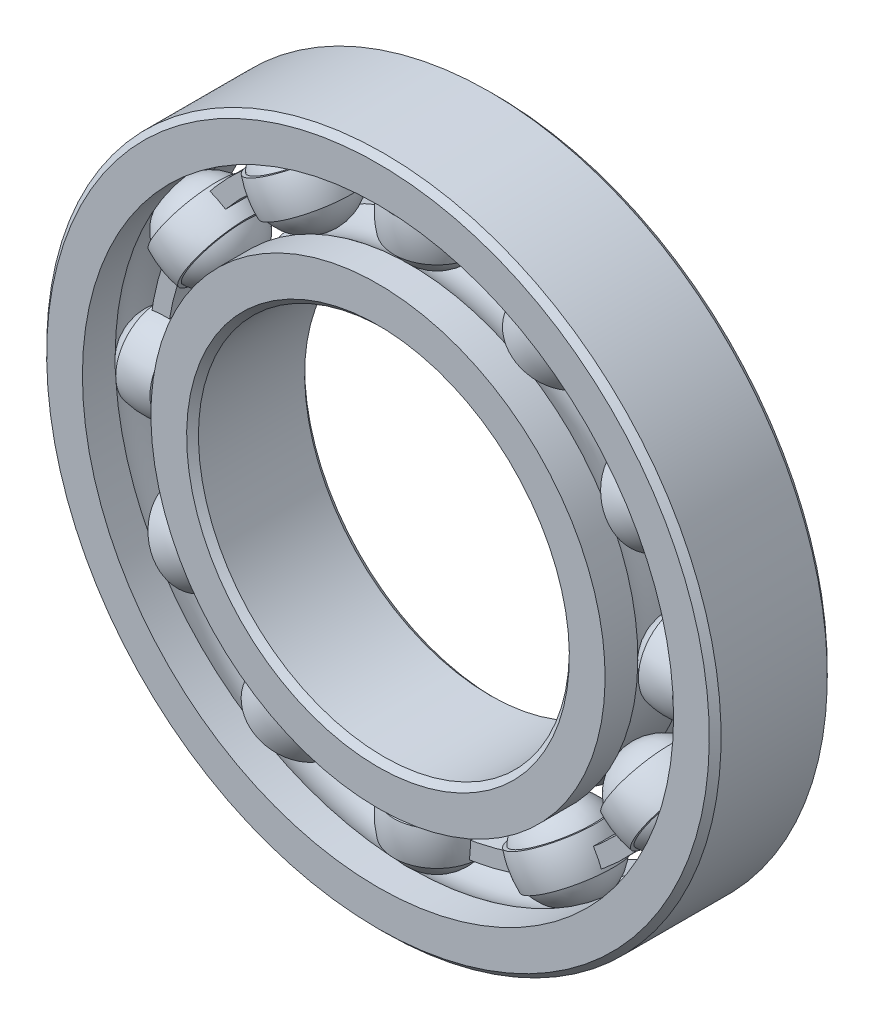
from build123d import *

# Parameters (mm, degrees)
CIRPATTERN1_COUNT   = 12
SKETCH9_R           = 26.218173077
SKETCH9_R_2         = 24.60625
BOSS_EXTRUDE1_DEPTH = 0.926041667


with BuildPart() as part:
    # Sketch7 → Revolve6 (revolve)
    with BuildSketch(Plane(origin=(0, 0, 0), x_dir=(0, 0, -1), z_dir=(1, 0, 0)), mode=Mode.PRIVATE) as revolve6_sk:
        with BuildLine():
            Line((5.000625, 31.75), (5.55625, 31.194375))
            Line((5.55625, 31.194375), (5.55625, 27.830096154))
            Line((5.55625, 27.830096154), (2.469444444, 27.830096154))
            ThreePointArc((2.469444444, 27.830096154), (0, 28.667203076), (-2.469444444, 27.830096154))
            Line((-2.469444444, 27.830096154), (-5.55625, 27.830096154))
            Line((-5.55625, 27.830096154), (-5.55625, 31.194375))
            Line((-5.55625, 31.194375), (-5.000625, 31.75))
            Line((-5.000625, 31.75), (5.000625, 31.75))
        make_face()
    revolve(revolve6_sk.sketch.rotate(Axis((0, 0, 5.55625), (0, 0, -1)), 180), axis=Axis((0, 0, 5.55625), (0, 0, -1)))


with BuildPart() as body_2:
    # Sketch3 → Revolve3 (revolve)
    with BuildSketch(Plane(origin=(0, 0, 0), x_dir=(0, 0, -1), z_dir=(1, 0, 0)), mode=Mode.PRIVATE) as revolve3_sk:
        with BuildLine():
            Line((-5.000625, 17.4625), (-5.55625, 18.018125))
            Line((-5.55625, 18.018125), (-5.55625, 21.382403846))
            Line((-5.55625, 21.382403846), (-2.469444444, 21.382403846))
            ThreePointArc((-2.469444444, 21.382403846), (0, 20.545296924), (2.469444444, 21.382403846))
            Line((2.469444444, 21.382403846), (5.55625, 21.382403846))
            Line((5.55625, 21.382403846), (5.55625, 18.018125))
            Line((5.55625, 18.018125), (5.000625, 17.4625))
            Line((5.000625, 17.4625), (-5.000625, 17.4625))
        make_face()
    revolve(revolve3_sk.sketch.rotate(Axis((0, 0, 5.55625), (0, 0, -1)), 180), axis=Axis((0, 0, 5.55625), (0, 0, -1)))


with BuildPart() as body_3:
    # Sketch4 → Revolve4 (revolve)
    with BuildSketch(Plane(origin=(0, 0, 0), x_dir=(0, 0, -1), z_dir=(1, 0, 0))):
        with BuildLine():
            Line((-4.060953076, 24.60625), (4.060953076, 24.60625))
            ThreePointArc((4.060953076, 24.60625), (0, 28.667203076), (-4.060953076, 24.60625))
        make_face()
    revolve(axis=Axis((0, 24.60625, 4.060953076), (0, 0, -1)))


with BuildPart() as body_4:
    # Sketch8 → Revolve7 (revolve)
    with BuildSketch(Plane(origin=(0, 0, 0), x_dir=(0, 0, -1), z_dir=(1, 0, 0))):
        with BuildLine():
            Line((-3.727337372, 26.218173077), (-4.032156143, 26.218173077))
            ThreePointArc((-4.032156143, 26.218173077), (-4.184565529, 24.60625), (-4.032156143, 22.994326923))
            Line((-4.032156143, 22.994326923), (-3.727337372, 22.994326923))
            ThreePointArc((-3.727337372, 22.994326923), (-4.060953076, 24.60625), (-3.727337372, 26.218173077))
        make_face()
    revolve(axis=Axis((0, 31.75, 0), (0, -1, 0)))


with BuildPart() as cirpattern1_1:
    # CirPattern1: pattern copy
    add(body_4.part.rotate(Axis((0, 0, 0), (0, 0, 1)), 1 * 360 / CIRPATTERN1_COUNT))


with BuildPart() as cirpattern1_2:
    # CirPattern1: pattern copy
    add(body_4.part.rotate(Axis((0, 0, 0), (0, 0, 1)), 2 * 360 / CIRPATTERN1_COUNT))


with BuildPart() as cirpattern1_3:
    # CirPattern1: pattern copy
    add(body_4.part.rotate(Axis((0, 0, 0), (0, 0, 1)), 3 * 360 / CIRPATTERN1_COUNT))


with BuildPart() as cirpattern1_4:
    # CirPattern1: pattern copy
    add(body_4.part.rotate(Axis((0, 0, 0), (0, 0, 1)), 4 * 360 / CIRPATTERN1_COUNT))


with BuildPart() as cirpattern1_5:
    # CirPattern1: pattern copy
    add(body_4.part.rotate(Axis((0, 0, 0), (0, 0, 1)), 5 * 360 / CIRPATTERN1_COUNT))


with BuildPart() as cirpattern1_6:
    # CirPattern1: pattern copy
    add(body_4.part.rotate(Axis((0, 0, 0), (0, 0, 1)), 6 * 360 / CIRPATTERN1_COUNT))


with BuildPart() as cirpattern1_7:
    # CirPattern1: pattern copy
    add(body_4.part.rotate(Axis((0, 0, 0), (0, 0, 1)), 7 * 360 / CIRPATTERN1_COUNT))


with BuildPart() as cirpattern1_8:
    # CirPattern1: pattern copy
    add(body_4.part.rotate(Axis((0, 0, 0), (0, 0, 1)), 8 * 360 / CIRPATTERN1_COUNT))


with BuildPart() as cirpattern1_9:
    # CirPattern1: pattern copy
    add(body_4.part.rotate(Axis((0, 0, 0), (0, 0, 1)), 9 * 360 / CIRPATTERN1_COUNT))


with BuildPart() as cirpattern1_10:
    # CirPattern1: pattern copy
    add(body_4.part.rotate(Axis((0, 0, 0), (0, 0, 1)), 10 * 360 / CIRPATTERN1_COUNT))


with BuildPart() as cirpattern1_11:
    # CirPattern1: pattern copy
    add(body_4.part.rotate(Axis((0, 0, 0), (0, 0, 1)), 11 * 360 / CIRPATTERN1_COUNT))


with BuildPart() as cirpattern1_12:
    # CirPattern1: pattern copy
    add(body_3.part.rotate(Axis((0, 0, 0), (0, 0, 1)), 1 * 360 / CIRPATTERN1_COUNT))


with BuildPart() as cirpattern1_13:
    # CirPattern1: pattern copy
    add(body_3.part.rotate(Axis((0, 0, 0), (0, 0, 1)), 2 * 360 / CIRPATTERN1_COUNT))


with BuildPart() as cirpattern1_14:
    # CirPattern1: pattern copy
    add(body_3.part.rotate(Axis((0, 0, 0), (0, 0, 1)), 3 * 360 / CIRPATTERN1_COUNT))


with BuildPart() as cirpattern1_15:
    # CirPattern1: pattern copy
    add(body_3.part.rotate(Axis((0, 0, 0), (0, 0, 1)), 4 * 360 / CIRPATTERN1_COUNT))


with BuildPart() as cirpattern1_16:
    # CirPattern1: pattern copy
    add(body_3.part.rotate(Axis((0, 0, 0), (0, 0, 1)), 5 * 360 / CIRPATTERN1_COUNT))


with BuildPart() as cirpattern1_17:
    # CirPattern1: pattern copy
    add(body_3.part.rotate(Axis((0, 0, 0), (0, 0, 1)), 6 * 360 / CIRPATTERN1_COUNT))


with BuildPart() as cirpattern1_18:
    # CirPattern1: pattern copy
    add(body_3.part.rotate(Axis((0, 0, 0), (0, 0, 1)), 7 * 360 / CIRPATTERN1_COUNT))


with BuildPart() as cirpattern1_19:
    # CirPattern1: pattern copy
    add(body_3.part.rotate(Axis((0, 0, 0), (0, 0, 1)), 8 * 360 / CIRPATTERN1_COUNT))


with BuildPart() as cirpattern1_20:
    # CirPattern1: pattern copy
    add(body_3.part.rotate(Axis((0, 0, 0), (0, 0, 1)), 9 * 360 / CIRPATTERN1_COUNT))


with BuildPart() as cirpattern1_21:
    # CirPattern1: pattern copy
    add(body_3.part.rotate(Axis((0, 0, 0), (0, 0, 1)), 10 * 360 / CIRPATTERN1_COUNT))


with BuildPart() as cirpattern1_22:
    # CirPattern1: pattern copy
    add(body_3.part.rotate(Axis((0, 0, 0), (0, 0, 1)), 11 * 360 / CIRPATTERN1_COUNT))


with BuildPart() as body_27:
    # Sketch9 → Boss-Extrude1 (new, symmetric)
    with BuildSketch(Plane.XY):
        Circle(SKETCH9_R)
        Circle(SKETCH9_R_2, mode=Mode.SUBTRACT)
    extrude(amount=BOSS_EXTRUDE1_DEPTH, both=True)


solid = Compound([part.part, body_2.part, body_3.part, body_4.part, cirpattern1_1.part, cirpattern1_2.part, cirpattern1_3.part, cirpattern1_4.part, cirpattern1_5.part, cirpattern1_6.part, cirpattern1_7.part, cirpattern1_8.part, cirpattern1_9.part, cirpattern1_10.part, cirpattern1_11.part, cirpattern1_12.part, cirpattern1_13.part, cirpattern1_14.part, cirpattern1_15.part, cirpattern1_16.part, cirpattern1_17.part, cirpattern1_18.part, cirpattern1_19.part, cirpattern1_20.part, cirpattern1_21.part, cirpattern1_22.part, body_27.part])
